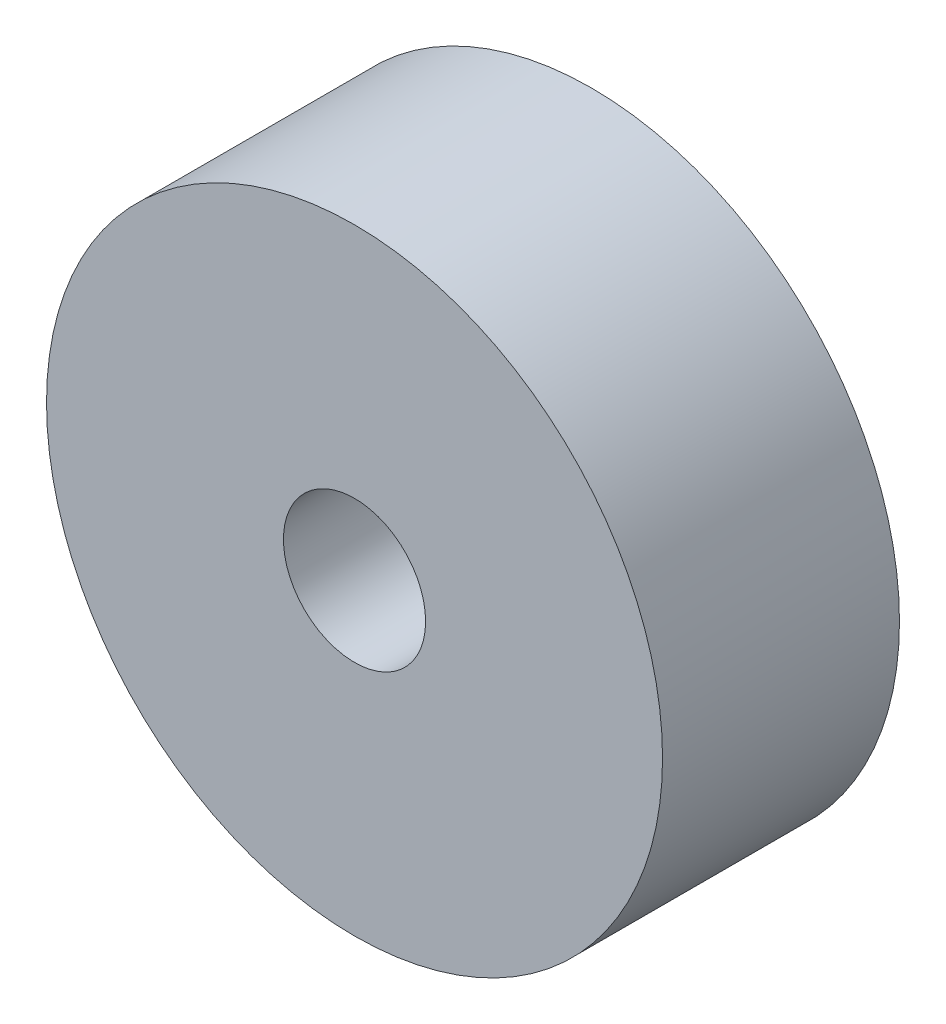
from build123d import *

# Parameters (mm, degrees)
SKETCH_1_R      = 26
SKETCH_1_R_2    = 6
EXTRUDE_1_DEPTH = 20


with BuildPart() as part:
    # 草图1 → 凸台-拉伸1 (new body)
    with BuildSketch(Plane.XY):
        Circle(SKETCH_1_R)
        Circle(SKETCH_1_R_2, mode=Mode.SUBTRACT)
    extrude(amount=EXTRUDE_1_DEPTH)


solid = part.part
